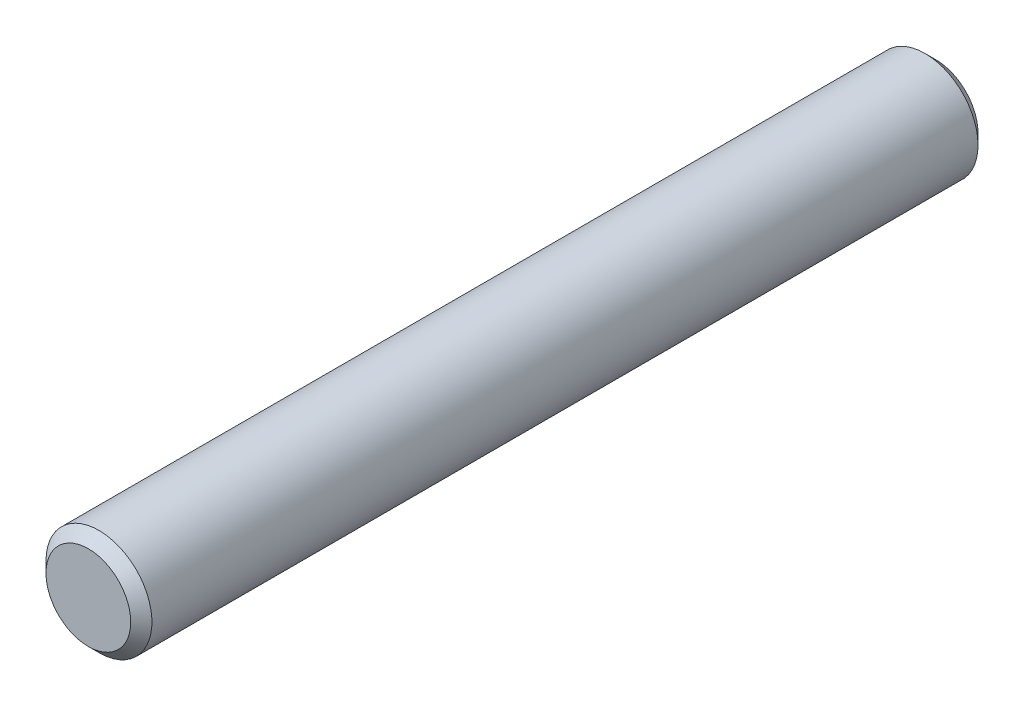
from build123d import *

# Parameters (mm, degrees)
SKETCH3_R           = 4.7625
BOSS_EXTRUDE1_DEPTH = 38.1
CHAMFER1_SIZE       = 0.9525


with BuildPart() as part:
    # Sketch3 → Boss-Extrude1 (new, symmetric)
    with BuildSketch(Plane.XY):
        with Locations(Location((0, 0, 0), (0, 0, 180))):
            Circle(SKETCH3_R)
    extrude(amount=BOSS_EXTRUDE1_DEPTH, both=True)

    # Chamfer1
    chamfer1_edges = [part.edges().sort_by_distance(p)[0] for p in [
        (4.7625, 0, -38.1),
        (4.7625, 0, 38.1),
    ]]
    chamfer(chamfer1_edges, length=CHAMFER1_SIZE)


solid = part.part
